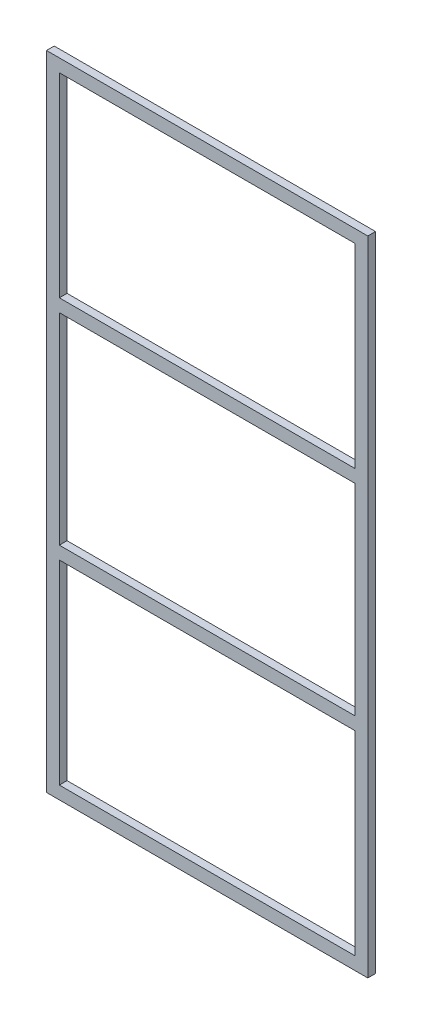
from build123d import *

# Parameters (mm, degrees)
ESBO_O1_W                = 250
ESBO_O1_H                = 500
RESSALTO_EXTRUS_O1_DEPTH = 6
ESBO_O3_W                = 230
ESBO_O3_H                = 156.67
ESBO_O3_H_2              = 151.666666
ESBO_O3_H_3              = 151.663334
CORTE_EXTRUS_O1_DEPTH    = 10


with BuildPart() as part:
    # Esboço1 → Ressalto-extrusão1 (new body)
    with BuildSketch(Plane.XY):
        with Locations((125, -250)):
            Rectangle(ESBO_O1_W, ESBO_O1_H)
    extrude(amount=RESSALTO_EXTRUS_O1_DEPTH)

    # Esboço3 → Corte-extrusão1 (cut)
    with BuildSketch(Plane.XY.offset(6)):
        with Locations((125, -250.001666)):
            Rectangle(ESBO_O3_W, ESBO_O3_H)
        with Locations((125, -85.833333)):
            Rectangle(ESBO_O3_W, ESBO_O3_H_2)
        with Locations((125, -414.168333)):
            Rectangle(ESBO_O3_W, ESBO_O3_H_3)
    extrude(amount=-CORTE_EXTRUS_O1_DEPTH, mode=Mode.SUBTRACT)


solid = part.part
